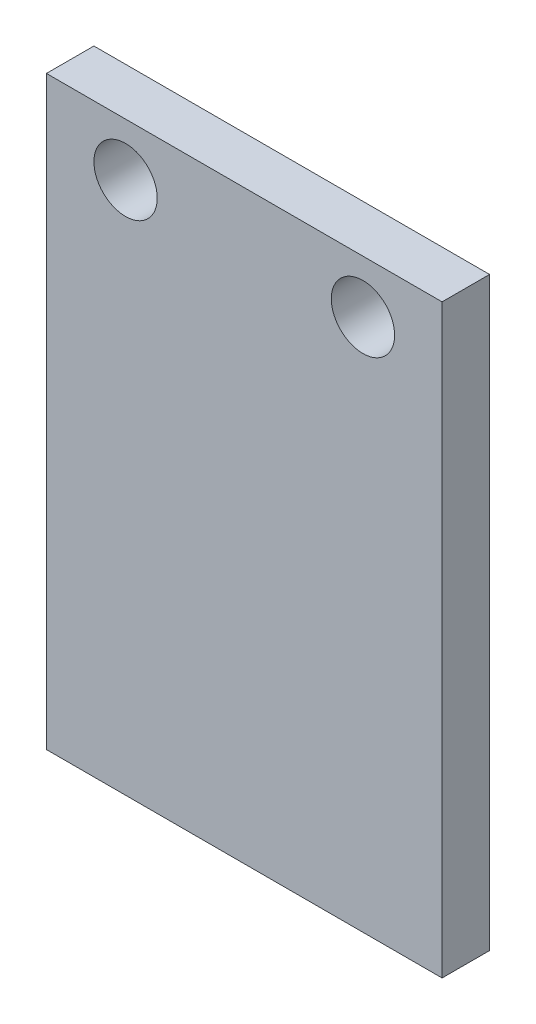
from build123d import *

# Parameters (mm, degrees)
CROQUIS1_W              = 25
CROQUIS1_H              = 37
CROQUIS1_R              = 2
SALIENTE_EXTRUIR1_DEPTH = 1.5


with BuildPart() as part:
    # Croquis1 → Saliente-Extruir1 (new, symmetric)
    with BuildSketch(Plane.XY):
        Rectangle(CROQUIS1_W, CROQUIS1_H)
        with Locations((-7.5, 15.17)):
            Circle(CROQUIS1_R, mode=Mode.SUBTRACT)
        with Locations((7.5, 15.17)):
            Circle(CROQUIS1_R, mode=Mode.SUBTRACT)
    extrude(amount=SALIENTE_EXTRUIR1_DEPTH, both=True)


solid = part.part
